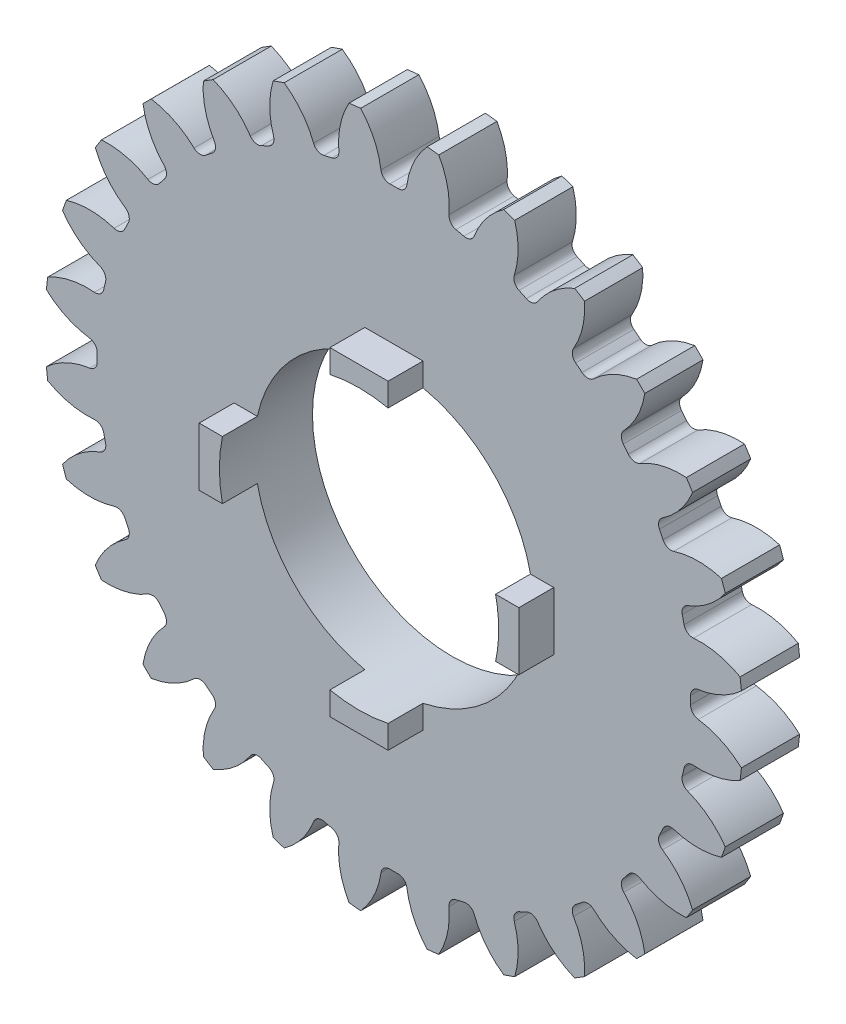
from build123d import *

# Parameters (mm, degrees)
SKETCH1_R                = 30
BOSS_EXTRUDE1_DEPTH      = 5
CUT_EXTRUDE1_DEPTH       = 10
FILLET2_R                = 0.76
CIRPATTERN2_COUNT        = 28
FILLET2_OF_CIRPATTERN2_R = 0.76
SKETCH2_R                = 12
CUT_EXTRUDE2_DEPTH       = 5
BOSS_EXTRUDE2_START      = 3
BOSS_EXTRUDE2_DEPTH      = 3


with BuildPart() as part:
    # Sketch1 → Boss-Extrude1 (new body)
    with BuildSketch(Plane.XY):
        Circle(SKETCH1_R)
    extrude(amount=-BOSS_EXTRUDE1_DEPTH)

    # Sketch1<4> → Cut-Extrude1 (cut)
    with BuildSketch(Plane.XY):
        with BuildLine():
            ThreePointArc((-1.051932947, 25.478293449), (0, 25.5), (1.051932947, 25.478293449))
            ThreePointArc((1.051932947, 25.478293449), (1.568965291, 27.830805059), (2.861628912, 29.863206123))
            ThreePointArc((2.861628912, 29.863206123), (0, 30), (-2.861628912, 29.863206123))
            ThreePointArc((-2.861628912, 29.863206123), (-1.568965291, 27.830805059), (-1.051932947, 25.478293449))
        make_face()
    cut_extrude1 = extrude(amount=-CUT_EXTRUDE1_DEPTH, mode=Mode.SUBTRACT)

    # Fillet2
    fillet2_edges = [part.edges().sort_by_distance(p)[0] for p in [
        (1.051932947, 25.478293449, -2.5),
        (-1.051932947, 25.478293449, -2.5),
    ]]
    fillet(fillet2_edges, radius=FILLET2_R)

    # CirPattern2: Cut-Extrude1 ×28 about axis
    cirpattern2_axis = Axis((0, 0, 0), (0, 0, 1))
    for i in range(1, CIRPATTERN2_COUNT):
        add(cut_extrude1.rotate(cirpattern2_axis, i * 360 / CIRPATTERN2_COUNT), mode=Mode.SUBTRACT)

    # Fillet2 of CirPattern2
    fillet2_of_cirpattern2_edges = [part.edges().sort_by_distance(p)[0] for p in [
        (-4.643894863, 25.07357654, -2.5),
        (-6.695012445, 24.605422337, -2.5),
        (-10.106858392, 23.411565805, -2.5),
        (-12.002376064, 22.498732605, -2.5),
        (-15.063021839, 20.575601402, -2.5),
        (-16.707890429, 19.263862474, -2.5),
        (-19.263862474, 16.707890429, -2.5),
        (-20.575601402, 15.063021839, -2.5),
        (-22.498732605, 12.002376064, -2.5),
        (-23.411565805, 10.106858392, -2.5),
        (-24.605422337, 6.695012445, -2.5),
        (-25.07357654, 4.643894863, -2.5),
        (-25.478293449, 1.051932947, -2.5),
        (-25.478293449, -1.051932947, -2.5),
        (-25.07357654, -4.643894863, -2.5),
        (-24.605422337, -6.695012445, -2.5),
        (-23.411565805, -10.106858392, -2.5),
        (-22.498732605, -12.002376064, -2.5),
        (-20.575601402, -15.063021839, -2.5),
        (-19.263862474, -16.707890429, -2.5),
        (-16.707890429, -19.263862474, -2.5),
        (-15.063021839, -20.575601402, -2.5),
        (-12.002376064, -22.498732605, -2.5),
        (-10.106858392, -23.411565805, -2.5),
        (-6.695012445, -24.605422337, -2.5),
        (-4.643894863, -25.07357654, -2.5),
        (-1.051932947, -25.478293449, -2.5),
        (1.051932947, -25.478293449, -2.5),
        (4.643894863, -25.07357654, -2.5),
        (6.695012445, -24.605422337, -2.5),
        (10.106858392, -23.411565805, -2.5),
        (12.002376064, -22.498732605, -2.5),
        (15.063021839, -20.575601402, -2.5),
        (16.707890429, -19.263862474, -2.5),
        (19.263862474, -16.707890429, -2.5),
        (20.575601402, -15.063021839, -2.5),
        (22.498732605, -12.002376064, -2.5),
        (23.411565805, -10.106858392, -2.5),
        (24.605422337, -6.695012445, -2.5),
        (25.07357654, -4.643894863, -2.5),
        (25.478293449, -1.051932947, -2.5),
        (25.478293449, 1.051932947, -2.5),
        (25.07357654, 4.643894863, -2.5),
        (24.605422337, 6.695012445, -2.5),
        (23.411565805, 10.106858392, -2.5),
        (22.498732605, 12.002376064, -2.5),
        (20.575601402, 15.063021839, -2.5),
        (19.263862474, 16.707890429, -2.5),
        (16.707890429, 19.263862474, -2.5),
        (15.063021839, 20.575601402, -2.5),
        (12.002376064, 22.498732605, -2.5),
        (10.106858392, 23.411565805, -2.5),
        (6.695012445, 24.605422337, -2.5),
        (4.643894863, 25.07357654, -2.5),
    ]]
    fillet(fillet2_of_cirpattern2_edges, radius=FILLET2_OF_CIRPATTERN2_R)

    # Sketch2 → Cut-Extrude2 (cut)
    with BuildSketch(Plane.XY):
        Circle(SKETCH2_R)
    extrude(amount=-CUT_EXTRUDE2_DEPTH, mode=Mode.SUBTRACT)

    # Sketch3 → Boss-Extrude2 (add)
    with BuildSketch(Plane.XY.offset(BOSS_EXTRUDE2_START)):
        with BuildLine():
            Line((-2.5, 11.736694594), (-2.5, 13.736694594))
            Line((-2.5, 13.736694594), (2.5, 13.736694594))
            Line((2.5, 13.736694594), (2.5, 11.736694594))
            ThreePointArc((2.5, 11.736694594), (0, 12), (-2.5, 11.736694594))
        make_face()
        with BuildLine():
            Line((13.736694594, -2.5), (11.736694594, -2.5))
            ThreePointArc((11.736694594, -2.5), (12, 0), (11.736694594, 2.5))
            Line((11.736694594, 2.5), (13.736694594, 2.5))
            Line((13.736694594, 2.5), (13.736694594, -2.5))
        make_face()
        with BuildLine():
            Line((-2.5, -13.736694594), (-2.5, -11.736694594))
            ThreePointArc((-2.5, -11.736694594), (0, -12), (2.5, -11.736694594))
            Line((2.5, -11.736694594), (2.5, -13.736694594))
            Line((2.5, -13.736694594), (-2.5, -13.736694594))
        make_face()
        with BuildLine():
            Line((-13.736694594, 2.5), (-11.736694594, 2.5))
            ThreePointArc((-11.736694594, 2.5), (-12, 0), (-11.736694594, -2.5))
            Line((-11.736694594, -2.5), (-13.736694594, -2.5))
            Line((-13.736694594, -2.5), (-13.736694594, 2.5))
        make_face()
    extrude(amount=-BOSS_EXTRUDE2_DEPTH)


solid = part.part
